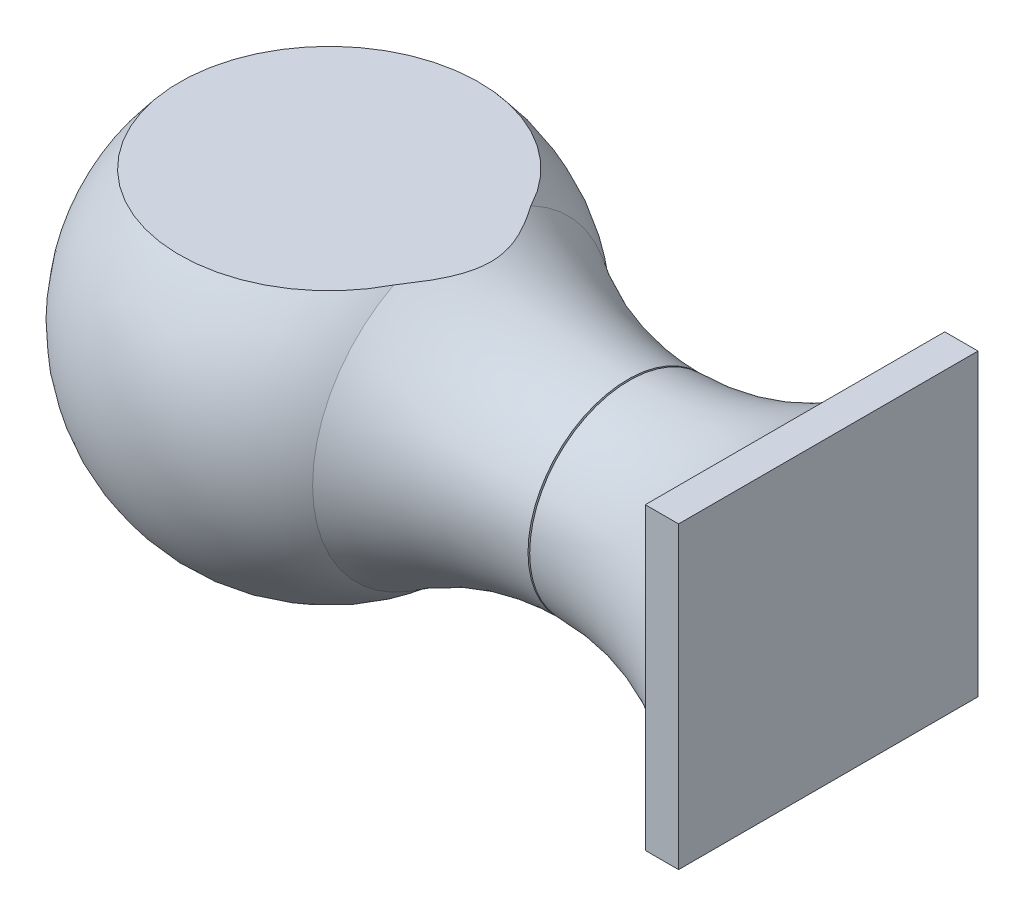
from build123d import *

# Parameters (mm, degrees)
SKETCH3_W               = 90
SKETCH3_H               = 90
BOSS_EXTRUDE1_DEPTH     = 10
CUT_EXTRUDE1_DEPTH      = 20
CUT_EXTRUDE1_DEPTH_BACK = 20
SKETCH7_W               = 132.063759526
SKETCH7_H               = 133.30964405


with BuildPart() as part:
    # Sketch2 → Revolve1 (revolve)
    with BuildSketch(Plane(origin=(0, 0, 0), x_dir=(1, 0, 0), z_dir=(0, 1, 0))):
        with BuildLine():
            Line((-50, 0), (-0.25, 0))
            Line((-0.25, 0), (-0.25, 30.000344037))
            ThreePointArc((-0.25, 30.000344037), (-26.220469957, 33.866779994), (-50, 45))
            Line((-50, 45), (-50, 0))
        make_face()
        with BuildLine():
            Line((50, 45), (50, 0))
            Line((50, 0), (0.25, 0))
            Line((0.25, 0), (0.25, 30.000344037))
            ThreePointArc((0.25, 30.000344037), (26.220469957, 33.866779994), (50, 45))
        make_face()
    revolve(axis=Axis((-50, 0, 0), (1, 0, 0)))

    # Sketch3 → Boss-Extrude1 (add)
    with BuildSketch(Plane(origin=(50, 0, 0), x_dir=(0, 0, -1), z_dir=(1, 0, 0))):
        Rectangle(SKETCH3_W, SKETCH3_H)
    extrude(amount=BOSS_EXTRUDE1_DEPTH)

    # Sketch5 → Revolve8 (revolve)
    with BuildSketch(Plane(origin=(0, 0, 0), x_dir=(1, 0, 0), z_dir=(0, 1, 0))):
        with BuildLine():
            Line((-150.207972894, 0), (-29.792027106, 0))
            ThreePointArc((-29.792027106, 0), (-90, 60.207972894), (-150.207972894, 0))
        make_face()
    revolve(axis=Axis((-150.207972894, 0, 0), (1, 0, 0)))

    # Sketch7 → Cut-Extrude1 (cut, two sides: drawn at the far end of the back side and taken through both)
    with BuildSketch(Plane(origin=(0, 60, 0), x_dir=(1, 0, 0), z_dir=(0, 1, 0)).offset(-CUT_EXTRUDE1_DEPTH_BACK)):
        with Locations((-91.700067638, 0)):
            Rectangle(SKETCH7_W, SKETCH7_H)
    extrude(amount=CUT_EXTRUDE1_DEPTH + CUT_EXTRUDE1_DEPTH_BACK, mode=Mode.SUBTRACT)


solid = part.part
